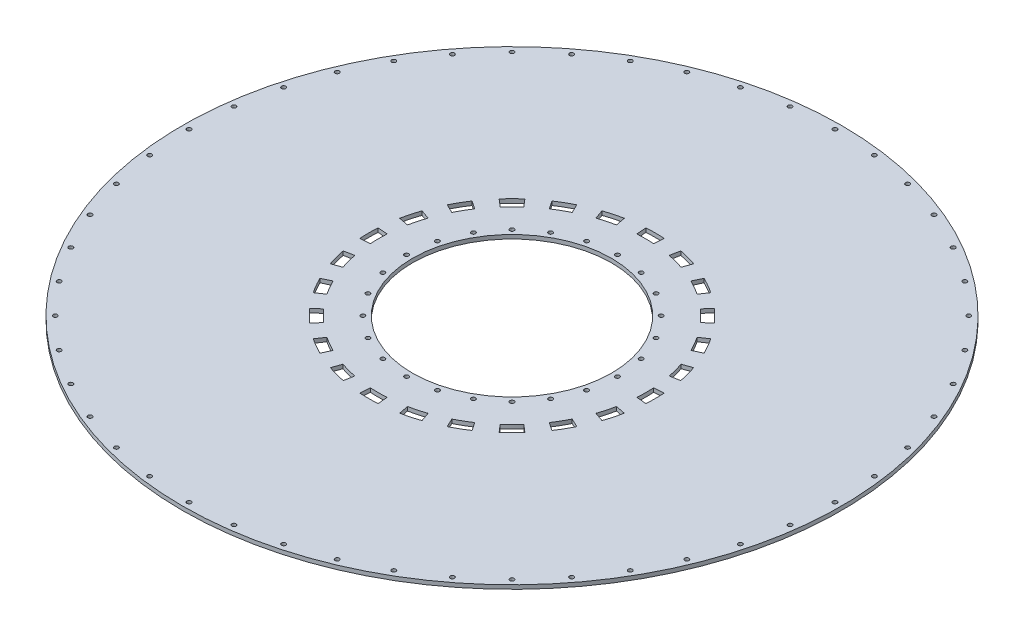
from build123d import *

# Parameters (mm, degrees)
SKETCH2_R           = 250
SKETCH2_R_2         = 1.6
SKETCH2_R_3         = 75.5
BOSS_EXTRUDE1_DEPTH = 1.5


with BuildPart() as part:
    # Sketch2 → Boss-Extrude1 (new, symmetric)
    with BuildSketch(Plane(origin=(0, 0, 0), x_dir=(1, 0, 0), z_dir=(0, 1, 0))):
        with Locations(Location((0, 0, 0), (0, 0, 270))):
            Circle(SKETCH2_R)
        with Locations(Location((-149.146550107, -194.371568371, 0), (0, 0, 270))):
            Circle(SKETCH2_R_2, mode=Mode.SUBTRACT)
        with Locations(Location((-194.371568371, -149.146550107, 0), (0, 0, 270))):
            Circle(SKETCH2_R_2, mode=Mode.SUBTRACT)
        with Locations(Location((-173.241161391, -173.241161391, 0), (0, 0, 270))):
            Circle(SKETCH2_R_2, mode=Mode.SUBTRACT)
        with Locations(Location((-93.757440929, -226.350485465, 0), (0, 0, 270))):
            Circle(SKETCH2_R_2, mode=Mode.SUBTRACT)
        with Locations(Location((-63.41066605, -236.651827441, 0), (0, 0, 270))):
            Circle(SKETCH2_R_2, mode=Mode.SUBTRACT)
        with Locations(Location((-122.5, -212.176223927, 0), (0, 0, 270))):
            Circle(SKETCH2_R_2, mode=Mode.SUBTRACT)
        with Locations(Location((-31.978917094, -242.903991037, 0), (0, 0, 270))):
            Circle(SKETCH2_R_2, mode=Mode.SUBTRACT)
        with Locations(Location((-226.350485465, -93.757440929, 0), (0, 0, 270))):
            Circle(SKETCH2_R_2, mode=Mode.SUBTRACT)
        with Locations(Location((-212.176223927, -122.5, 0), (0, 0, 270))):
            Circle(SKETCH2_R_2, mode=Mode.SUBTRACT)
        with Locations(Location((-236.651827441, -63.41066605, 0), (0, 0, 270))):
            Circle(SKETCH2_R_2, mode=Mode.SUBTRACT)
        with Locations(Location((-242.903991037, -31.978917094, 0), (0, 0, 270))):
            Circle(SKETCH2_R_2, mode=Mode.SUBTRACT)
        with Locations(Location((-245, 0, 0), (0, 0, 270))):
            Circle(SKETCH2_R_2, mode=Mode.SUBTRACT)
        with BuildLine():
            Line((-66.965979429, -75.941557129), (-71.856943192, -81.62807247))
            ThreePointArc((-71.856943192, -81.62807247), (-76.897862454, -76.897862454), (-81.62807247, -71.856943192))
            Line((-81.62807247, -71.856943192), (-75.941557129, -66.965979429))
            ThreePointArc((-75.941557129, -66.965979429), (-71.594561595, -71.594561595), (-66.965979429, -75.941557129))
        make_face(mode=Mode.SUBTRACT)
        with BuildLine():
            Line((-20.02346081, -99.250307391), (-21.415902008, -106.620456017))
            ThreePointArc((-21.415902008, -106.620456017), (-28.146571155, -105.044433609), (-34.763512824, -103.043974477))
            Line((-34.763512824, -103.043974477), (-32.284327962, -95.965017939))
            ThreePointArc((-32.284327962, -95.965017939), (-26.205428317, -97.799989912), (-20.02346081, -99.250307391))
        make_face(mode=Mode.SUBTRACT)
        with BuildLine():
            Line((-45.029047713, -90.68598217), (-48.281577457, -97.444608769))
            ThreePointArc((-48.281577457, -97.444608769), (-54.375, -94.180262662), (-60.248717928, -90.535376998))
            Line((-60.248717928, -90.535376998), (-56.021840469, -84.339290313))
            ThreePointArc((-56.021840469, -84.339290313), (-50.625, -87.685072133), (-45.029047713, -90.68598217))
        make_face(mode=Mode.SUBTRACT)
        with Locations(Location((-40, -69.282032303, 0), (0, 0, 270))):
            Circle(SKETCH2_R_2, mode=Mode.SUBTRACT)
        with Locations(Location((0, -80, 0), (0, 0, 270))):
            Circle(SKETCH2_R_2, mode=Mode.SUBTRACT)
        with Locations(Location((-20.705523608, -77.274066103, 0), (0, 0, 270))):
            Circle(SKETCH2_R_2, mode=Mode.SUBTRACT)
        with BuildLine():
            Line((-84.339290313, -56.021840469), (-90.535376998, -60.248717928))
            ThreePointArc((-90.535376998, -60.248717928), (-94.180262662, -54.375), (-97.444608769, -48.281577457))
            Line((-97.444608769, -48.281577457), (-90.68598217, -45.029047713))
            ThreePointArc((-90.68598217, -45.029047713), (-87.685072133, -50.625), (-84.339290313, -56.021840469))
        make_face(mode=Mode.SUBTRACT)
        with Locations(Location((-69.282032303, -40, 0), (0, 0, 270))):
            Circle(SKETCH2_R_2, mode=Mode.SUBTRACT)
        with BuildLine():
            Line((-95.965017939, -32.284327962), (-103.043974477, -34.763512824))
            ThreePointArc((-103.043974477, -34.763512824), (-105.044433609, -28.146571155), (-106.620456017, -21.415902008))
            Line((-106.620456017, -21.415902008), (-99.250307391, -20.02346081))
            ThreePointArc((-99.250307391, -20.02346081), (-97.799989912, -26.205428317), (-95.965017939, -32.284327962))
        make_face(mode=Mode.SUBTRACT)
        with BuildLine():
            Line((-101.050888182, -6.346691857), (-108.530295385, -6.909231772))
            ThreePointArc((-108.530295385, -6.909231772), (-108.75, 0), (-108.530295385, 6.909231772))
            Line((-108.530295385, 6.909231772), (-101.050888182, 6.346691857))
            ThreePointArc((-101.050888182, 6.346691857), (-101.25, 0), (-101.050888182, -6.346691857))
        make_face(mode=Mode.SUBTRACT)
        with Locations(Location((-77.274066103, -20.705523608, 0), (0, 0, 270))):
            Circle(SKETCH2_R_2, mode=Mode.SUBTRACT)
        with Locations(Location((-56.568542495, -56.568542495, 0), (0, 0, 270))):
            Circle(SKETCH2_R_2, mode=Mode.SUBTRACT)
        with Locations(Location((0, -245, 0), (0, 0, 270))):
            Circle(SKETCH2_R_2, mode=Mode.SUBTRACT)
        with Locations(Location((31.978917094, -242.903991037, 0), (0, 0, 270))):
            Circle(SKETCH2_R_2, mode=Mode.SUBTRACT)
        with Locations(Location((63.41066605, -236.651827441, 0), (0, 0, 270))):
            Circle(SKETCH2_R_2, mode=Mode.SUBTRACT)
        with Locations(Location((93.757440929, -226.350485465, 0), (0, 0, 270))):
            Circle(SKETCH2_R_2, mode=Mode.SUBTRACT)
        with Locations(Location((122.5, -212.176223927, 0), (0, 0, 270))):
            Circle(SKETCH2_R_2, mode=Mode.SUBTRACT)
        with Locations(Location((149.146550107, -194.371568371, 0), (0, 0, 270))):
            Circle(SKETCH2_R_2, mode=Mode.SUBTRACT)
        with Locations(Location((173.241161391, -173.241161391, 0), (0, 0, 270))):
            Circle(SKETCH2_R_2, mode=Mode.SUBTRACT)
        with Locations(Location((194.371568371, -149.146550107, 0), (0, 0, 270))):
            Circle(SKETCH2_R_2, mode=Mode.SUBTRACT)
        with BuildLine():
            Line((6.346691857, -101.050888182), (6.909231772, -108.530295385))
            ThreePointArc((6.909231772, -108.530295385), (0, -108.75), (-6.909231772, -108.530295385))
            Line((-6.909231772, -108.530295385), (-6.346691857, -101.050888182))
            ThreePointArc((-6.346691857, -101.050888182), (0, -101.25), (6.346691857, -101.050888182))
        make_face(mode=Mode.SUBTRACT)
        with BuildLine():
            Line((32.284327962, -95.965017939), (34.763512824, -103.043974477))
            ThreePointArc((34.763512824, -103.043974477), (28.146571155, -105.044433609), (21.415902008, -106.620456017))
            Line((21.415902008, -106.620456017), (20.02346081, -99.250307391))
            ThreePointArc((20.02346081, -99.250307391), (26.205428317, -97.799989912), (32.284327962, -95.965017939))
        make_face(mode=Mode.SUBTRACT)
        with Locations(Location((20.705523608, -77.274066103, 0), (0, 0, 270))):
            Circle(SKETCH2_R_2, mode=Mode.SUBTRACT)
        with BuildLine():
            Line((56.021840469, -84.339290313), (60.248717928, -90.535376998))
            ThreePointArc((60.248717928, -90.535376998), (54.375, -94.180262662), (48.281577457, -97.444608769))
            Line((48.281577457, -97.444608769), (45.029047713, -90.68598217))
            ThreePointArc((45.029047713, -90.68598217), (50.625, -87.685072133), (56.021840469, -84.339290313))
        make_face(mode=Mode.SUBTRACT)
        with Locations(Location((40, -69.282032303, 0), (0, 0, 270))):
            Circle(SKETCH2_R_2, mode=Mode.SUBTRACT)
        with BuildLine():
            Line((75.941557129, -66.965979429), (81.62807247, -71.856943192))
            ThreePointArc((81.62807247, -71.856943192), (76.897862454, -76.897862454), (71.856943192, -81.62807247))
            Line((71.856943192, -81.62807247), (66.965979429, -75.941557129))
            ThreePointArc((66.965979429, -75.941557129), (71.594561595, -71.594561595), (75.941557129, -66.965979429))
        make_face(mode=Mode.SUBTRACT)
        with Locations(Location((56.568542495, -56.568542495, 0), (0, 0, 270))):
            Circle(SKETCH2_R_2, mode=Mode.SUBTRACT)
        with BuildLine():
            Line((90.68598217, -45.029047713), (97.444608769, -48.281577457))
            ThreePointArc((97.444608769, -48.281577457), (94.180262662, -54.375), (90.535376998, -60.248717928))
            Line((90.535376998, -60.248717928), (84.339290313, -56.021840469))
            ThreePointArc((84.339290313, -56.021840469), (87.685072133, -50.625), (90.68598217, -45.029047713))
        make_face(mode=Mode.SUBTRACT)
        with Locations(Location((69.282032303, -40, 0), (0, 0, 270))):
            Circle(SKETCH2_R_2, mode=Mode.SUBTRACT)
        with Locations(Location((77.274066103, -20.705523608, 0), (0, 0, 270))):
            Circle(SKETCH2_R_2, mode=Mode.SUBTRACT)
        with BuildLine():
            Line((99.250307391, -20.02346081), (106.620456017, -21.415902008))
            ThreePointArc((106.620456017, -21.415902008), (105.044433609, -28.146571155), (103.043974477, -34.763512824))
            Line((103.043974477, -34.763512824), (95.965017939, -32.284327962))
            ThreePointArc((95.965017939, -32.284327962), (97.799989912, -26.205428317), (99.250307391, -20.02346081))
        make_face(mode=Mode.SUBTRACT)
        with Locations(Location((212.176223927, -122.5, 0), (0, 0, 270))):
            Circle(SKETCH2_R_2, mode=Mode.SUBTRACT)
        with Locations(Location((226.350485465, -93.757440929, 0), (0, 0, 270))):
            Circle(SKETCH2_R_2, mode=Mode.SUBTRACT)
        with Locations(Location((236.651827441, -63.41066605, 0), (0, 0, 270.000000001))):
            Circle(SKETCH2_R_2, mode=Mode.SUBTRACT)
        with Locations(Location((242.903991037, -31.978917094, 0), (0, 0, 270))):
            Circle(SKETCH2_R_2, mode=Mode.SUBTRACT)
        with Locations(Location((-242.903991037, 31.978917094, 0), (0, 0, 270))):
            Circle(SKETCH2_R_2, mode=Mode.SUBTRACT)
        with Locations(Location((-236.651827441, 63.41066605, 0), (0, 0, 270))):
            Circle(SKETCH2_R_2, mode=Mode.SUBTRACT)
        with Locations(Location((-226.350485465, 93.757440929, 0), (0, 0, 270))):
            Circle(SKETCH2_R_2, mode=Mode.SUBTRACT)
        with Locations(Location((-212.176223927, 122.5, 0), (0, 0, 270))):
            Circle(SKETCH2_R_2, mode=Mode.SUBTRACT)
        with BuildLine():
            Line((-99.250307391, 20.02346081), (-106.620456017, 21.415902008))
            ThreePointArc((-106.620456017, 21.415902008), (-105.044433609, 28.146571155), (-103.043974477, 34.763512824))
            Line((-103.043974477, 34.763512824), (-95.965017939, 32.284327962))
            ThreePointArc((-95.965017939, 32.284327962), (-97.799989912, 26.205428317), (-99.250307391, 20.02346081))
        make_face(mode=Mode.SUBTRACT)
        with Locations(Location((-80, 0, 0), (0, 0, 270))):
            Circle(SKETCH2_R_2, mode=Mode.SUBTRACT)
        with Locations(Location((-77.274066103, 20.705523608, 0), (0, 0, 270))):
            Circle(SKETCH2_R_2, mode=Mode.SUBTRACT)
        with Locations(Location((-69.282032303, 40, 0), (0, 0, 270))):
            Circle(SKETCH2_R_2, mode=Mode.SUBTRACT)
        with BuildLine():
            Line((-90.68598217, 45.029047713), (-97.444608769, 48.281577457))
            ThreePointArc((-97.444608769, 48.281577457), (-94.180262662, 54.375), (-90.535376998, 60.248717928))
            Line((-90.535376998, 60.248717928), (-84.339290313, 56.021840469))
            ThreePointArc((-84.339290313, 56.021840469), (-87.685072133, 50.625), (-90.68598217, 45.029047713))
        make_face(mode=Mode.SUBTRACT)
        with Locations(Location((-56.568542495, 56.568542495, 0), (0, 0, 270))):
            Circle(SKETCH2_R_2, mode=Mode.SUBTRACT)
        with BuildLine():
            Line((-75.941557129, 66.965979429), (-81.62807247, 71.856943192))
            ThreePointArc((-81.62807247, 71.856943192), (-76.897862454, 76.897862454), (-71.856943192, 81.62807247))
            Line((-71.856943192, 81.62807247), (-66.965979429, 75.941557129))
            ThreePointArc((-66.965979429, 75.941557129), (-71.594561595, 71.594561595), (-75.941557129, 66.965979429))
        make_face(mode=Mode.SUBTRACT)
        with Locations(Location((-40, 69.282032303, 0), (0, 0, 270))):
            Circle(SKETCH2_R_2, mode=Mode.SUBTRACT)
        with BuildLine():
            Line((-56.021840469, 84.339290313), (-60.248717928, 90.535376998))
            ThreePointArc((-60.248717928, 90.535376998), (-54.375, 94.180262662), (-48.281577457, 97.444608769))
            Line((-48.281577457, 97.444608769), (-45.029047713, 90.68598217))
            ThreePointArc((-45.029047713, 90.68598217), (-50.625, 87.685072133), (-56.021840469, 84.339290313))
        make_face(mode=Mode.SUBTRACT)
        with Locations(Location((-20.705523608, 77.274066103, 0), (0, 0, 270))):
            Circle(SKETCH2_R_2, mode=Mode.SUBTRACT)
        with BuildLine():
            Line((-32.284327962, 95.965017939), (-34.763512824, 103.043974477))
            ThreePointArc((-34.763512824, 103.043974477), (-28.146571155, 105.044433609), (-21.415902008, 106.620456017))
            Line((-21.415902008, 106.620456017), (-20.02346081, 99.250307391))
            ThreePointArc((-20.02346081, 99.250307391), (-26.205428317, 97.799989912), (-32.284327962, 95.965017939))
        make_face(mode=Mode.SUBTRACT)
        with Locations(Location((-194.371568371, 149.146550107, 0), (0, 0, 270))):
            Circle(SKETCH2_R_2, mode=Mode.SUBTRACT)
        with Locations(Location((-173.241161391, 173.241161391, 0), (0, 0, 270))):
            Circle(SKETCH2_R_2, mode=Mode.SUBTRACT)
        with Locations(Location((-149.146550107, 194.371568371, 0), (0, 0, 270))):
            Circle(SKETCH2_R_2, mode=Mode.SUBTRACT)
        with Locations(Location((-122.5, 212.176223927, 0), (0, 0, 270))):
            Circle(SKETCH2_R_2, mode=Mode.SUBTRACT)
        with Locations(Location((-93.757440929, 226.350485465, 0), (0, 0, 270))):
            Circle(SKETCH2_R_2, mode=Mode.SUBTRACT)
        with Locations(Location((-63.41066605, 236.651827441, 0), (0, 0, 270))):
            Circle(SKETCH2_R_2, mode=Mode.SUBTRACT)
        with Locations(Location((-31.978917094, 242.903991037, 0), (0, 0, 270))):
            Circle(SKETCH2_R_2, mode=Mode.SUBTRACT)
        with Locations(Location((0, 0, 0), (0, 0, 270))):
            Circle(SKETCH2_R_3, mode=Mode.SUBTRACT)
        with Locations(Location((56.568542495, 56.568542495, 0), (0, 0, 270))):
            Circle(SKETCH2_R_2, mode=Mode.SUBTRACT)
        with Locations(Location((80, 0, 0), (0, 0, 270))):
            Circle(SKETCH2_R_2, mode=Mode.SUBTRACT)
        with Locations(Location((77.274066103, 20.705523608, 0), (0, 0, 270))):
            Circle(SKETCH2_R_2, mode=Mode.SUBTRACT)
        with BuildLine():
            Line((101.050888182, 6.346691857), (108.530295385, 6.909231772))
            ThreePointArc((108.530295385, 6.909231772), (108.75, 0), (108.530295385, -6.909231772))
            Line((108.530295385, -6.909231772), (101.050888182, -6.346691857))
            ThreePointArc((101.050888182, -6.346691857), (101.25, 0), (101.050888182, 6.346691857))
        make_face(mode=Mode.SUBTRACT)
        with BuildLine():
            Line((95.965017939, 32.284327962), (103.043974477, 34.763512824))
            ThreePointArc((103.043974477, 34.763512824), (105.044433609, 28.146571155), (106.620456017, 21.415902008))
            Line((106.620456017, 21.415902008), (99.250307391, 20.02346081))
            ThreePointArc((99.250307391, 20.02346081), (97.799989912, 26.205428317), (95.965017939, 32.284327962))
        make_face(mode=Mode.SUBTRACT)
        with Locations(Location((69.282032303, 40, 0), (0, 0, 270))):
            Circle(SKETCH2_R_2, mode=Mode.SUBTRACT)
        with BuildLine():
            Line((84.339290313, 56.021840469), (90.535376998, 60.248717928))
            ThreePointArc((90.535376998, 60.248717928), (94.180262662, 54.375), (97.444608769, 48.281577457))
            Line((97.444608769, 48.281577457), (90.68598217, 45.029047713))
            ThreePointArc((90.68598217, 45.029047713), (87.685072133, 50.625), (84.339290313, 56.021840469))
        make_face(mode=Mode.SUBTRACT)
        with Locations(Location((20.705523608, 77.274066103, 0), (0, 0, 270))):
            Circle(SKETCH2_R_2, mode=Mode.SUBTRACT)
        with Locations(Location((0, 80, 0), (0, 0, 270))):
            Circle(SKETCH2_R_2, mode=Mode.SUBTRACT)
        with Locations(Location((40, 69.282032303, 0), (0, 0, 270))):
            Circle(SKETCH2_R_2, mode=Mode.SUBTRACT)
        with BuildLine():
            Line((45.029047713, 90.68598217), (48.281577457, 97.444608769))
            ThreePointArc((48.281577457, 97.444608769), (54.375, 94.180262662), (60.248717928, 90.535376998))
            Line((60.248717928, 90.535376998), (56.021840469, 84.339290313))
            ThreePointArc((56.021840469, 84.339290313), (50.625, 87.685072133), (45.029047713, 90.68598217))
        make_face(mode=Mode.SUBTRACT)
        with BuildLine():
            Line((-6.346691857, 101.050888182), (-6.909231772, 108.530295385))
            ThreePointArc((-6.909231772, 108.530295385), (0, 108.75), (6.909231772, 108.530295385))
            Line((6.909231772, 108.530295385), (6.346691857, 101.050888182))
            ThreePointArc((6.346691857, 101.050888182), (0, 101.25), (-6.346691857, 101.050888182))
        make_face(mode=Mode.SUBTRACT)
        with BuildLine():
            Line((20.02346081, 99.250307391), (21.415902008, 106.620456017))
            ThreePointArc((21.415902008, 106.620456017), (28.146571155, 105.044433609), (34.763512824, 103.043974477))
            Line((34.763512824, 103.043974477), (32.284327962, 95.965017939))
            ThreePointArc((32.284327962, 95.965017939), (26.205428317, 97.799989912), (20.02346081, 99.250307391))
        make_face(mode=Mode.SUBTRACT)
        with BuildLine():
            Line((66.965979429, 75.941557129), (71.856943192, 81.62807247))
            ThreePointArc((71.856943192, 81.62807247), (76.897862454, 76.897862454), (81.62807247, 71.856943192))
            Line((81.62807247, 71.856943192), (75.941557129, 66.965979429))
            ThreePointArc((75.941557129, 66.965979429), (71.594561595, 71.594561595), (66.965979429, 75.941557129))
        make_face(mode=Mode.SUBTRACT)
        with Locations(Location((245, 0, 0), (0, 0, 270))):
            Circle(SKETCH2_R_2, mode=Mode.SUBTRACT)
        with Locations(Location((242.903991037, 31.978917094, 0), (0, 0, 270))):
            Circle(SKETCH2_R_2, mode=Mode.SUBTRACT)
        with Locations(Location((236.651827441, 63.41066605, 0), (0, 0, 270))):
            Circle(SKETCH2_R_2, mode=Mode.SUBTRACT)
        with Locations(Location((212.176223927, 122.5, 0), (0, 0, 270))):
            Circle(SKETCH2_R_2, mode=Mode.SUBTRACT)
        with Locations(Location((226.350485465, 93.757440929, 0), (0, 0, 270))):
            Circle(SKETCH2_R_2, mode=Mode.SUBTRACT)
        with Locations(Location((0, 245, 0), (0, 0, 270))):
            Circle(SKETCH2_R_2, mode=Mode.SUBTRACT)
        with Locations(Location((31.978917094, 242.903991037, 0), (0, 0, 270))):
            Circle(SKETCH2_R_2, mode=Mode.SUBTRACT)
        with Locations(Location((122.5, 212.176223927, 0), (0, 0, 270))):
            Circle(SKETCH2_R_2, mode=Mode.SUBTRACT)
        with Locations(Location((63.41066605, 236.651827441, 0), (0, 0, 270))):
            Circle(SKETCH2_R_2, mode=Mode.SUBTRACT)
        with Locations(Location((93.757440929, 226.350485465, 0), (0, 0, 270))):
            Circle(SKETCH2_R_2, mode=Mode.SUBTRACT)
        with Locations(Location((173.241161391, 173.241161391, 0), (0, 0, 270))):
            Circle(SKETCH2_R_2, mode=Mode.SUBTRACT)
        with Locations(Location((194.371568371, 149.146550107, 0), (0, 0, 270))):
            Circle(SKETCH2_R_2, mode=Mode.SUBTRACT)
        with Locations(Location((149.146550107, 194.371568371, 0), (0, 0, 270))):
            Circle(SKETCH2_R_2, mode=Mode.SUBTRACT)
    extrude(amount=BOSS_EXTRUDE1_DEPTH, both=True)


solid = part.part
